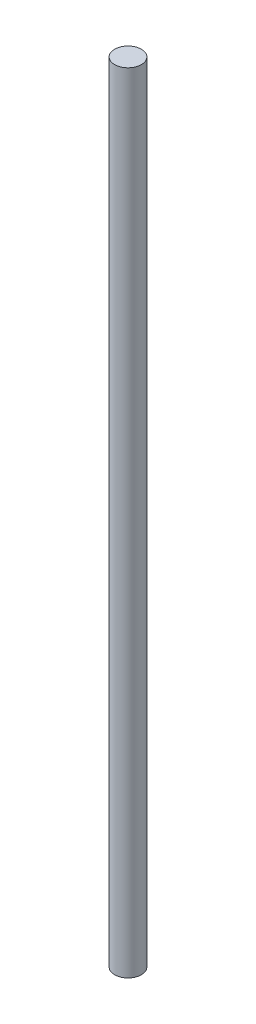
from build123d import *

# Parameters (mm, degrees)
SKETCH3_R           = 25.4
BOSS_EXTRUDE3_DEPTH = 1500


with BuildPart() as part:
    # Sketch3 → Boss-Extrude3 (new body)
    with BuildSketch(Plane(origin=(0, 0, 0), x_dir=(1, 0, 0), z_dir=(0, 1, 0))):
        with Locations(Location((0, 0, 0), (0, 0, 270))):
            Circle(SKETCH3_R)
    extrude(amount=BOSS_EXTRUDE3_DEPTH)


solid = part.part
